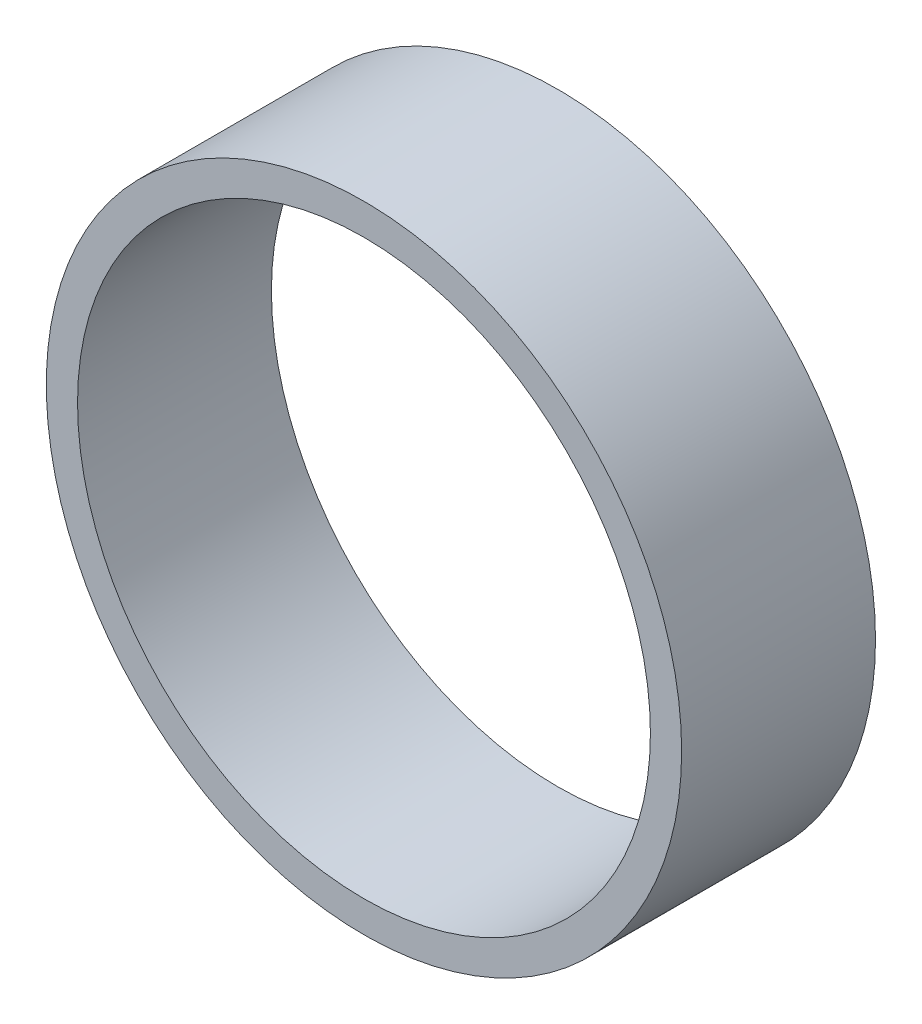
from build123d import *

# Parameters (mm, degrees)
SKETCH1_W = 16.9545
SKETCH1_H = 2.73125


with BuildPart() as part:
    # Sketch1 → Revolve1 (revolve)
    with BuildSketch(Plane(origin=(0, 0, 0), x_dir=(0, 0, -1), z_dir=(1, 0, 0)), mode=Mode.PRIVATE) as revolve1_sk:
        with Locations((0, 26.415625)):
            Rectangle(SKETCH1_W, SKETCH1_H)
    revolve(revolve1_sk.sketch.rotate(Axis((0, 0, 35.62703085), (0, 0, -1)), 90), axis=Axis((0, 0, 35.62703085), (0, 0, -1)))


solid = part.part
